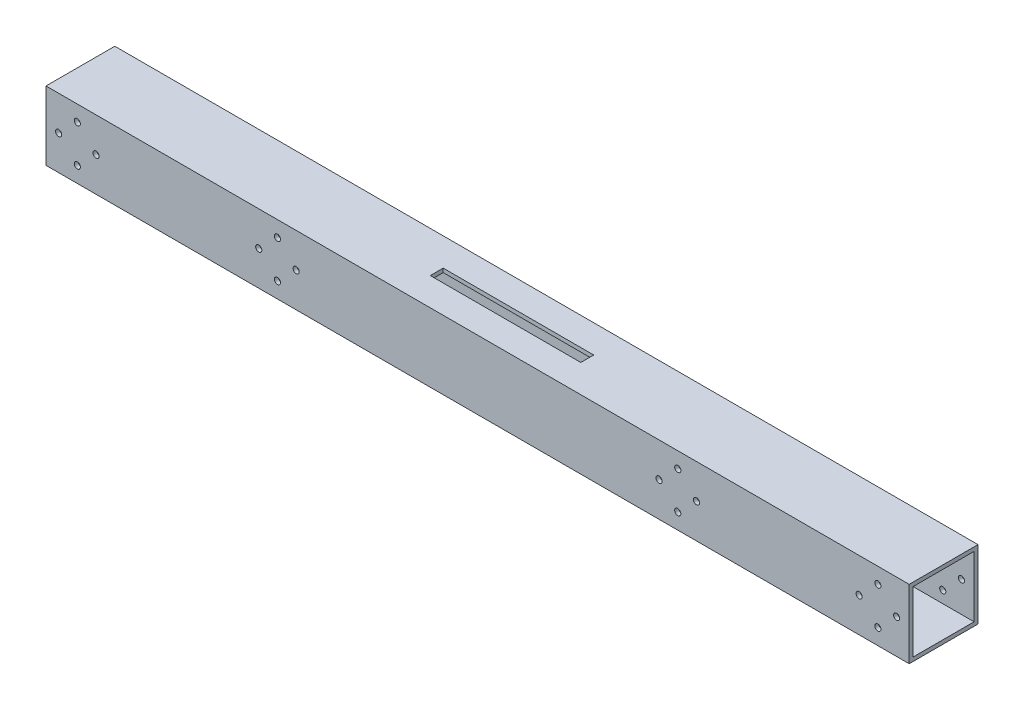
from build123d import *

# Parameters (mm, degrees)
SKETCH1_W               = 34.925
SKETCH1_H               = 34.925
SKETCH1_W_2             = 30.9626
SKETCH1_H_2             = 30.9626
BOSS_EXTRUDE1_DEPTH     = 219.075
SKETCH2_W               = 76.400000108
SKETCH2_H               = 6.550000108
CUT_EXTRUDE1_DEPTH      = 223.527639084
CUT_EXTRUDE3_DEPTH      = 221.462544296
CUT_EXTRUDE3_DEPTH_BACK = 221.462544296
SKETCH5_R               = 1.56250005
SKETCH6_R               = 1.56250005
CUT_EXTRUDE5_DEPTH      = 223.527639084


with BuildPart() as part:
    # Sketch1 → Boss-Extrude1 (new, symmetric)
    with BuildSketch(Plane(origin=(0, 0, 0), x_dir=(0, 0, -1), z_dir=(1, 0, 0))):
        Rectangle(SKETCH1_W, SKETCH1_H)
        Rectangle(SKETCH1_W_2, SKETCH1_H_2, mode=Mode.SUBTRACT)
    extrude(amount=BOSS_EXTRUDE1_DEPTH, both=True)

    # Sketch2 → Cut-Extrude1 (cut, through all)
    with BuildSketch(Plane(origin=(0, 17.4625, 0), x_dir=(1, 0, 0), z_dir=(0, 1, 0))):
        Rectangle(SKETCH2_W, SKETCH2_H)
    extrude(amount=-CUT_EXTRUDE1_DEPTH, mode=Mode.SUBTRACT)

    # Sketch5 → Cut-Extrude3 (cut, two sides: drawn at the far end of the back side and taken through both)
    with BuildSketch(Plane.XY.offset(-CUT_EXTRUDE3_DEPTH_BACK)):
        with Locations((-203.175, 9.5)):
            Circle(SKETCH5_R)
        with Locations((-193.675, 0)):
            Circle(SKETCH5_R)
        with Locations((-203.175, -9.5)):
            Circle(SKETCH5_R)
        with Locations((-212.675, 0)):
            Circle(SKETCH5_R)
        with Locations((212.675, 0)):
            Circle(SKETCH5_R)
        with Locations((203.175, -9.5)):
            Circle(SKETCH5_R)
        with Locations((193.675, 0)):
            Circle(SKETCH5_R)
        with Locations((203.175, 9.5)):
            Circle(SKETCH5_R)
    extrude(amount=CUT_EXTRUDE3_DEPTH + CUT_EXTRUDE3_DEPTH_BACK, mode=Mode.SUBTRACT)

    # Sketch6 → Cut-Extrude5 (cut, through all)
    with BuildSketch(Plane.XY.offset(17.4625)):
        with Locations((-101.6, 9.5)):
            Circle(SKETCH6_R)
        with Locations((-92.1, 0)):
            Circle(SKETCH6_R)
        with Locations((-101.6, -9.5)):
            Circle(SKETCH6_R)
        with Locations((-111.1, 0)):
            Circle(SKETCH6_R)
    cut_extrude5 = extrude(amount=-CUT_EXTRUDE5_DEPTH, mode=Mode.SUBTRACT)

    # Mirror1: Cut-Extrude5 across plane
    add(cut_extrude5.mirror(Plane(origin=(0, 0, 0), x_dir=(0, 0, 1), z_dir=(1, 0, 0))), mode=Mode.SUBTRACT)


solid = part.part
